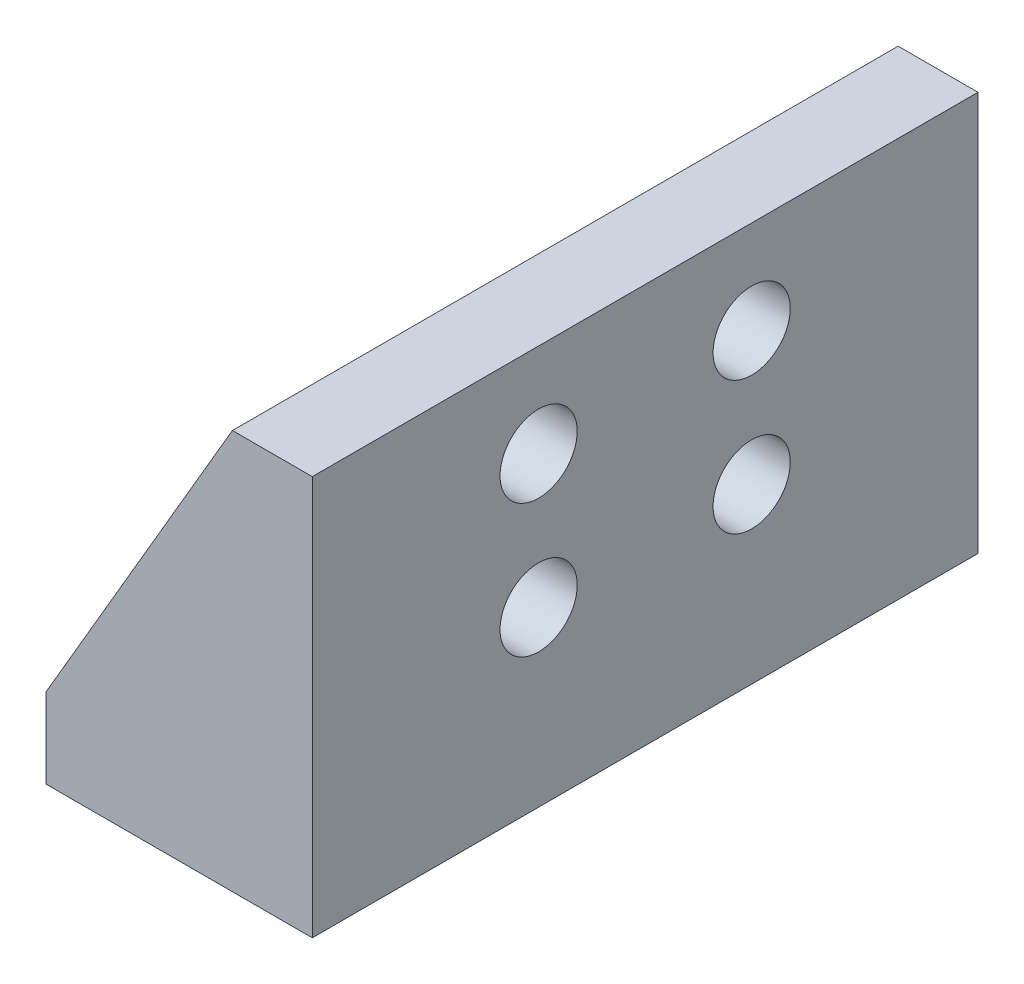
from build123d import *

# Parameters (mm, degrees)
EXTRUDE_2_DEPTH     = 25
EXTRUDE_3_DEPTH     = 5
EXTRUDE_5_DEPTH     = 5
SKETCH_8_R          = 1.45
CUT_EXTRUDE_3_DEPTH = 300
SKETCH_9_R          = 1.45
CUT_EXTRUDE_4_DEPTH = 300
SKETCH_10_R         = 2.6
CUT_EXTRUDE_5_DEPTH = 2


with BuildPart() as part:
    # 草图3 → 凸台-拉伸2 (new body)
    with BuildSketch(Plane.XY):
        Polygon((0, 0), (10, 0), (10, 15), (7, 15), (7, 3), (0, 3), align=None)
    extrude(amount=-EXTRUDE_2_DEPTH)

    # 草图4 → 凸台-拉伸3 (add)
    with BuildSketch(Plane.XY):
        Polygon((7, 15), (0, 3), (7, 3), align=None)
    extrude(amount=-EXTRUDE_3_DEPTH)

    # 草图5 → 凸台-拉伸5 (add)
    with BuildSketch(Plane(origin=(0, 0, -25), x_dir=(-1, 0, 0), z_dir=(0, 0, -1))):
        Polygon((-7, 15), (0, 3), (-7, 3), align=None)
    extrude(amount=-EXTRUDE_5_DEPTH)

    # 草图8 → 切除-拉伸3 (cut)
    with BuildSketch(Plane.ZY.offset(-7)):
        with Locations((-16.5, 11.5)):
            Circle(SKETCH_8_R)
        with Locations((-16.5, 6.5)):
            Circle(SKETCH_8_R)
        with Locations((-8.5, 6.5)):
            Circle(SKETCH_8_R)
        with Locations((-8.5, 11.5)):
            Circle(SKETCH_8_R)
    extrude(amount=-CUT_EXTRUDE_3_DEPTH, mode=Mode.SUBTRACT)

    # 草图9 → 切除-拉伸4 (cut)
    with BuildSketch(Plane(origin=(0, 3, 0), x_dir=(1, 0, 0), z_dir=(0, 1, 0))):
        with Locations(Location((3.5, 16.25, 0), (0, 0, 270))):
            Circle(SKETCH_9_R)
        with Locations(Location((3.5, 8.75, 0), (0, 0, 270))):
            Circle(SKETCH_9_R)
    extrude(amount=-CUT_EXTRUDE_4_DEPTH, mode=Mode.SUBTRACT)

    # 草图10 → 切除-拉伸5 (cut)
    with BuildSketch(Plane(origin=(0, 3, 0), x_dir=(1, 0, 0), z_dir=(0, 1, 0))):
        with Locations(Location((3.5, 16.25, 0), (0, 0, 270))):
            Circle(SKETCH_10_R)
        with Locations(Location((3.5, 8.75, 0), (0, 0, 270))):
            Circle(SKETCH_10_R)
    extrude(amount=-CUT_EXTRUDE_5_DEPTH, mode=Mode.SUBTRACT)


solid = part.part
